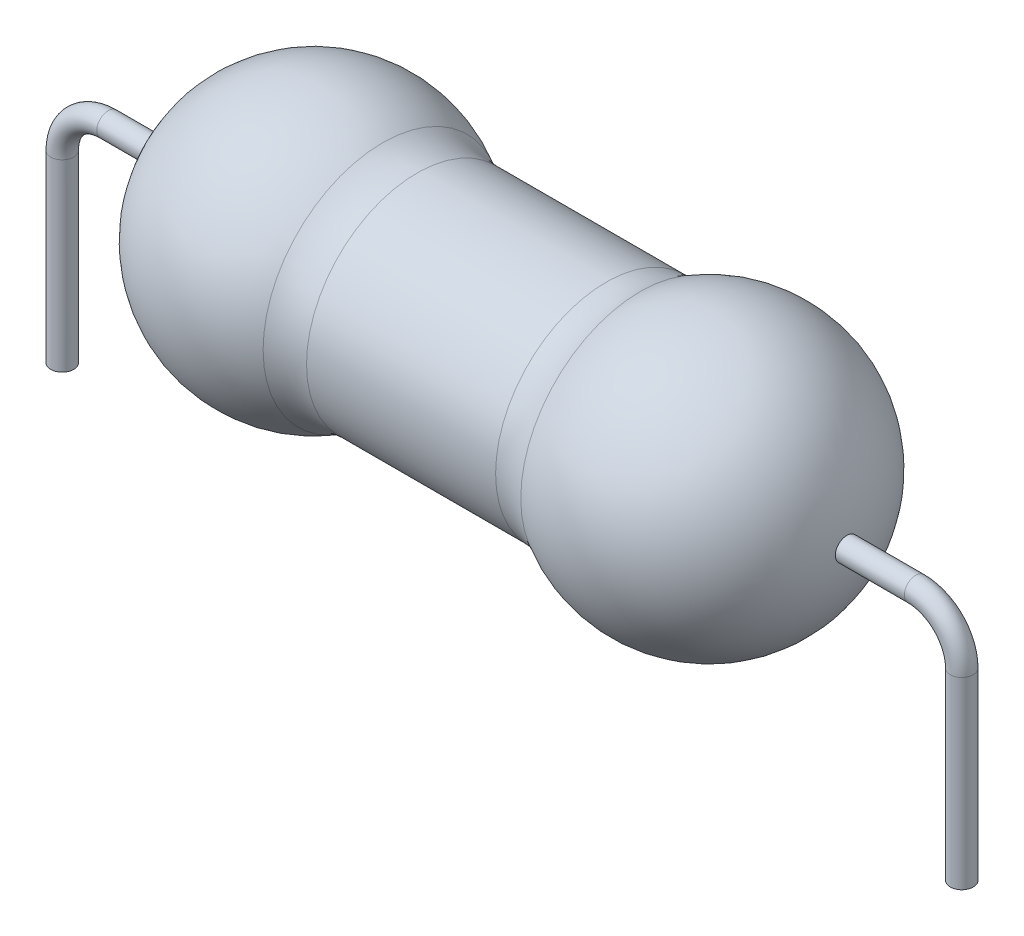
from build123d import *

# Parameters (mm, degrees)
IZIM6_R  = 0.5
IZIM12_R = 0.5


with BuildPart() as part:
    # Çizim3 → Döndür2 (revolve)
    with BuildSketch(Plane.XY, mode=Mode.PRIVATE) as d_nd_r2_sk:
        with BuildLine():
            Line((-17.937933441, 4.808326112), (-9.711177345, 4.808326112))
            ThreePointArc((-9.711177345, 4.808326112), (-8.939272594, 4.909332656), (-8.219346131, 5.205550741))
            ThreePointArc((-8.219346131, 5.205550741), (-2.227526009, 5.191434029), (0.764316296, 0))
            Line((0.764316296, 0), (-28.413427082, 0))
            ThreePointArc((-28.413427082, 0), (-25.421584777, 5.191434029), (-19.429764655, 5.205550741))
            ThreePointArc((-19.429764655, 5.205550741), (-18.709838192, 4.909332656), (-17.937933441, 4.808326112))
        make_face()
    revolve(d_nd_r2_sk.sketch.rotate(Axis((-28.413427082, 0, 0), (1, 0, 0)), 90), axis=Axis((-28.413427082, 0, 0), (1, 0, 0)))

    # Süpür4: sweep along a curve in space
    with BuildLine() as s_p_r4_path:
        Line((0.763145635, 0.002815014, 0), (3.763145635, 0.002815014, 0))
        ThreePointArc((3.763145635, 0.002815014, 0), (5.177359197, -0.582971423, 0), (5.763145635, -1.997184986, 0))
        Line((5.763145635, -1.997184986, 0), (5.763145635, -9.997184986, 0))
    # Çizim12 → Süpür4 (sweep)
    with BuildSketch(Plane(origin=(5.763145635, -9.997184986, 0), x_dir=(-1, 0, 0), z_dir=(0, -1, 0))):
        Circle(IZIM12_R)
    sweep(path=s_p_r4_path.line)


with BuildPart() as body_2:
    # Süpür2: sweep along a curve in space
    with BuildLine() as s_p_r2_path:
        Line((-33.415554198, -2.103436393, -0.04173432), (-33.415554198, -10.103436393, -0.04173432))
        ThreePointArc((-33.415554198, -2.103436393, -0.04173432), (-32.829767761, -0.689222831, -0.04173432), (-31.415554198, -0.103436393, -0.04173432))
        Line((-28.415554198, -0.103436393, -0.04173432), (-31.415554198, -0.103436393, -0.04173432))
    # Çizim6 → Süpür2 (sweep)
    with BuildSketch(Plane(origin=(-33.415554198, -10.103436393, -0.04173432), x_dir=(-1, 0, 0), z_dir=(0, -1, 0))):
        Circle(IZIM6_R)
    sweep(path=s_p_r2_path.line)


solid = Compound([part.part, body_2.part])
